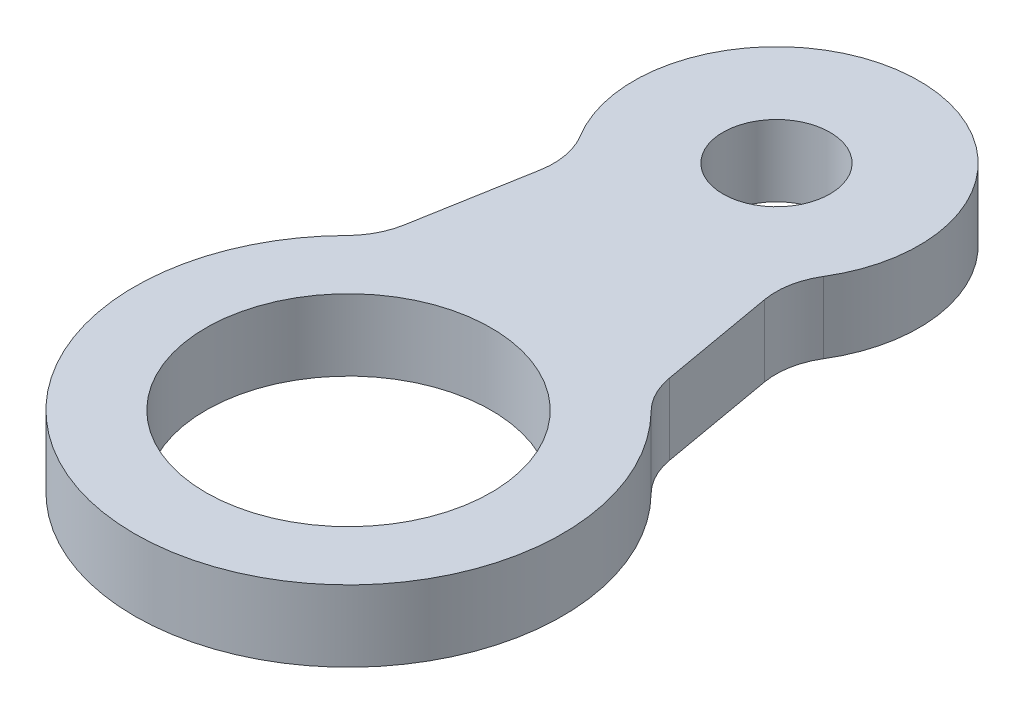
from build123d import *

# Parameters (mm, degrees)
SKETCH1_R           = 25.4
SKETCH1_R_2         = 9.525
BOSS_EXTRUDE1_DEPTH = 12.7
FILLET1_R           = 12.7


with BuildPart() as part:
    # Sketch1 → Boss-Extrude1 (new body)
    with BuildSketch(Plane(origin=(0, 0, 0), x_dir=(1, 0, 0), z_dir=(0, 1, 0))):
        with BuildLine():
            Line((-24.35791626, 29.296790191), (-19.05, 59.399479175))
            ThreePointArc((-19.05, 59.399479175), (0, 101.6), (19.05, 59.399479175))
            Line((19.05, 59.399479175), (24.35791626, 29.296790191))
            ThreePointArc((24.35791626, 29.296790191), (0, -38.1), (-24.35791626, 29.296790191))
        make_face()
        with Locations(Location((0, 0, 0), (0, 0, 270))):
            Circle(SKETCH1_R, mode=Mode.SUBTRACT)
        with Locations(Location((0, 76.2, 0), (0, 0, 270))):
            Circle(SKETCH1_R_2, mode=Mode.SUBTRACT)
    extrude(amount=BOSS_EXTRUDE1_DEPTH)

    # Fillet1
    fillet1_edges = [part.edges().sort_by_distance(p)[0] for p in [
        (19.05, 6.35, -59.399479175),
        (24.35791626, 6.35, -29.296790191),
        (-24.35791626, 6.35, -29.296790191),
        (-19.05, 6.35, -59.399479175),
    ]]
    fillet(fillet1_edges, radius=FILLET1_R)


solid = part.part
